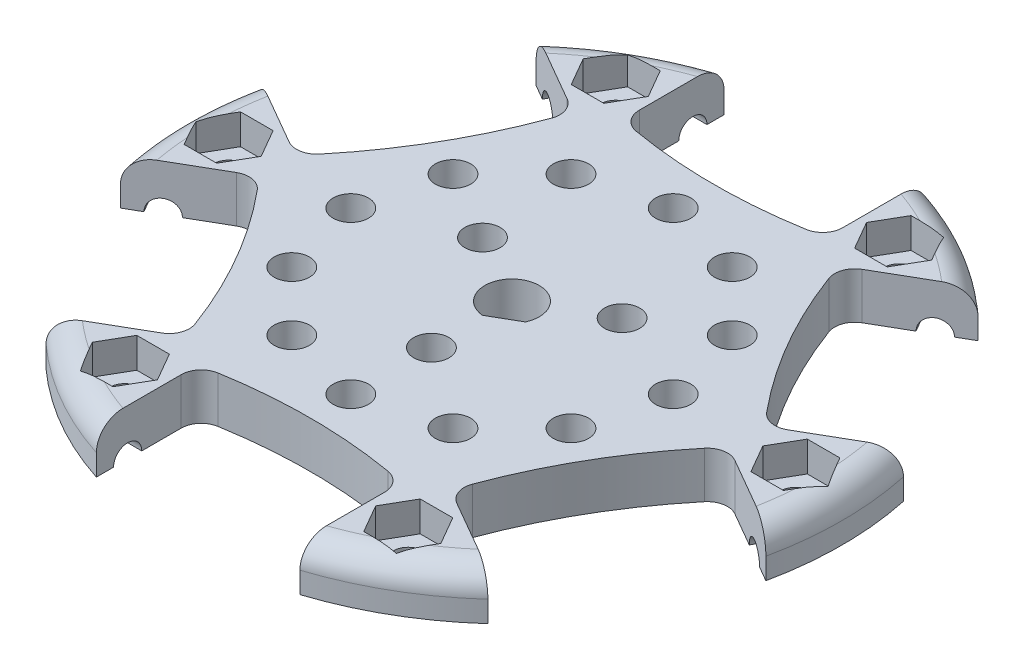
from build123d import *

# Parameters (mm, degrees)
CORTE_EXTRUS_O2_DEPTH  = 10
ESBO_O5_W              = 25.2
ESBO_O5_H              = 1.4
ESBO_O10_W             = 25.2
ESBO_O10_H             = 1.4
ESBO_O12_R             = 1.75
ESBO_O12_R_2           = 1.3
CORTE_EXTRUS_O4_DEPTH  = 46.434293366
CORTE_EXTRUS_O6_DEPTH  = 3
CORTE_EXTRUS_O7_DEPTH  = 10
ESBO_O16_R             = 1.5
CORTE_EXTRUS_O8_DEPTH  = 46.434293366
CORTE_EXTRUS_O9_DEPTH  = 3
CORTE_EXTRUS_O10_DEPTH = 46.434293366


with BuildPart() as part:
    # Esboço1 → Revolução3 (revolve)
    with BuildSketch(Plane.XY, mode=Mode.PRIVATE) as revolu_o3_sk:
        with BuildLine():
            Line((-32.75, 2.1), (-32.75, 0))
            Line((-32.75, 0), (0, 0))
            Line((0, 0), (0, 4.6))
            Line((0, 4.6), (-6.07, 4.6))
            Line((-6.07, 4.6), (-30.25, 4.6))
            ThreePointArc((-30.25, 4.6), (-32.017766953, 3.867766953), (-32.75, 2.1))
        make_face()
    revolve(revolu_o3_sk.sketch.rotate(Axis((0, 0, 0), (0, 1, 0)), 270), axis=Axis((0, 0, 0), (0, 1, 0)))

    # Esboço3 → Corte-extrusão2 (cut)
    with BuildSketch(Plane.XZ):
        with BuildLine():
            Line((-10.1, 71.55), (10.1, 71.55))
            Line((10.1, 71.55), (10.1, 22.738373522))
            ThreePointArc((10.1, 22.738373522), (9.628888485, 21.448993826), (8.4375, 20.767055752))
            ThreePointArc((8.4375, 20.767055752), (0, 20.05), (-8.4375, 20.767055752))
            ThreePointArc((-8.4375, 20.767055752), (-9.628888485, 21.448993826), (-10.1, 22.738373522))
            Line((-10.1, 22.738373522), (-10.1, 71.55))
        make_face()
        with BuildLine():
            Line((10.1, -71.55), (-10.1, -71.55))
            Line((-10.1, -71.55), (-10.1, -22.738373522))
            ThreePointArc((-10.1, -22.738373522), (-9.628888485, -21.448993826), (-8.4375, -20.767055752))
            ThreePointArc((-8.4375, -20.767055752), (0, -20.05), (8.4375, -20.767055752))
            ThreePointArc((8.4375, -20.767055752), (9.628888485, -21.448993826), (10.1, -22.738373522))
            Line((10.1, -22.738373522), (10.1, -71.55))
        make_face()
        with BuildLine():
            Line((56.914117641, 44.521856578), (67.014117641, 27.028143422))
            Line((67.014117641, 27.028143422), (24.742009111, 2.622330183))
            ThreePointArc((24.742009111, 2.622330183), (23.389817782, 2.385634875), (22.203547843, 3.076438532))
            ThreePointArc((22.203547843, 3.076438532), (17.363809346, 10.025), (13.766047843, 17.69061722))
            ThreePointArc((13.766047843, 17.69061722), (13.760929296, 19.063358951), (14.642009111, 20.116043339))
            Line((14.642009111, 20.116043339), (56.914117641, 44.521856578))
        make_face()
        with BuildLine():
            Line((-56.914117641, -44.521856578), (-67.014117641, -27.028143422))
            Line((-67.014117641, -27.028143422), (-24.742009111, -2.622330183))
            ThreePointArc((-24.742009111, -2.622330183), (-23.389817782, -2.385634875), (-22.203547843, -3.076438532))
            ThreePointArc((-22.203547843, -3.076438532), (-17.363809346, -10.025), (-13.766047843, -17.69061722))
            ThreePointArc((-13.766047843, -17.69061722), (-13.760929296, -19.063358951), (-14.642009111, -20.116043339))
            Line((-14.642009111, -20.116043339), (-56.914117641, -44.521856578))
        make_face()
        with BuildLine():
            Line((-67.014117641, 27.028143422), (-56.914117641, 44.521856578))
            Line((-56.914117641, 44.521856578), (-14.642009111, 20.116043339))
            ThreePointArc((-14.642009111, 20.116043339), (-13.760929296, 19.063358951), (-13.766047843, 17.69061722))
            ThreePointArc((-13.766047843, 17.69061722), (-17.363809346, 10.025), (-22.203547843, 3.076438532))
            ThreePointArc((-22.203547843, 3.076438532), (-23.389817782, 2.385634875), (-24.742009111, 2.622330183))
            Line((-24.742009111, 2.622330183), (-67.014117641, 27.028143422))
        make_face()
        with BuildLine():
            Line((67.014117641, -27.028143422), (56.914117641, -44.521856578))
            Line((56.914117641, -44.521856578), (14.642009111, -20.116043339))
            ThreePointArc((14.642009111, -20.116043339), (13.760929296, -19.063358951), (13.766047843, -17.69061722))
            ThreePointArc((13.766047843, -17.69061722), (17.363809346, -10.025), (22.203547843, -3.076438532))
            ThreePointArc((22.203547843, -3.076438532), (23.389817782, -2.385634875), (24.742009111, -2.622330183))
            Line((24.742009111, -2.622330183), (67.014117641, -27.028143422))
        make_face()
    extrude(amount=-CORTE_EXTRUS_O2_DEPTH, mode=Mode.SUBTRACT)

    # Esboço5 → Corte-Revolução3 (revolve, cut)
    with BuildSketch(Plane.XZ):
        with Locations((0, 27.35)):
            Rectangle(ESBO_O5_W, ESBO_O5_H)
    revolve(axis=Axis((-12.6, 0, 28.05), (1, 0, 0)), mode=Mode.SUBTRACT)

    # Esboço6 → Corte-Revolução4 (revolve, cut)
    with BuildSketch(Plane.XZ):
        Polygon((-29.379577011, 2.413079912), (-16.779577011, 24.236920088), (-17.992012576, 24.936920088), (-30.592012576, 3.113079912), align=None)
    revolve(axis=Axis((-30.592012576, 0, 3.113079912), (0.49999999999999983, 0, 0.8660254037844388)), mode=Mode.SUBTRACT)

    # Esboço7 → Corte-Revolução5 (revolve, cut)
    with BuildSketch(Plane.XZ):
        Polygon((-16.779577011, -24.236920088), (-29.379577011, -2.413079912), (-30.592012576, -3.113079912), (-17.992012576, -24.936920088), align=None)
    revolve(axis=Axis((-17.992012576, 0, -24.936920088), (-0.4999999999999998, 0, 0.8660254037844388)), mode=Mode.SUBTRACT)

    # Esboço8 → Corte-Revolução6 (revolve, cut)
    with BuildSketch(Plane.XZ):
        Polygon((16.779577011, 24.236920088), (29.379577011, 2.413079912), (30.592012576, 3.113079912), (17.992012576, 24.936920088), align=None)
    revolve(axis=Axis((17.992012576, 0, 24.936920088), (0.5000000000000001, 0, -0.8660254037844386)), mode=Mode.SUBTRACT)

    # Esboço10 → Corte-Revolução7 (revolve, cut)
    with BuildSketch(Plane.XZ):
        with Locations((0, -27.35)):
            Rectangle(ESBO_O10_W, ESBO_O10_H)
    revolve(axis=Axis((12.6, 0, -28.05), (-1, 0, 0)), mode=Mode.SUBTRACT)

    # Esboço11 → Corte-Revolução8 (revolve, cut)
    with BuildSketch(Plane.XZ):
        Polygon((29.379577011, -2.413079912), (16.779577011, -24.236920088), (17.992012576, -24.936920088), (30.592012576, -3.113079912), align=None)
    revolve(axis=Axis((30.592012576, 0, -3.113079912), (-0.49999999999999994, 0, -0.8660254037844387)), mode=Mode.SUBTRACT)

    # Esboço12 → Corte-extrusão4 (cut, through all)
    with BuildSketch(Plane.XZ):
        with Locations(Location((0, 16, 0), (0, 0, 270))):
            Circle(ESBO_O12_R)
        with Locations(Location((-8, 13.856406461, 0), (0, 0, 270))):
            Circle(ESBO_O12_R)
        with Locations(Location((-13.856406461, 8, 0), (0, 0, 270))):
            Circle(ESBO_O12_R)
        with Locations(Location((-16, 0, 0), (0, 0, 270))):
            Circle(ESBO_O12_R)
        with Locations(Location((-13.856406461, -8, 0), (0, 0, 270))):
            Circle(ESBO_O12_R)
        with Locations(Location((-8, -13.856406461, 0), (0, 0, 270))):
            Circle(ESBO_O12_R)
        with Locations(Location((0, -16, 0), (0, 0, 270))):
            Circle(ESBO_O12_R)
        with Locations(Location((8, -13.856406461, 0), (0, 0, 270))):
            Circle(ESBO_O12_R)
        with Locations(Location((13.856406461, -8, 0), (0, 0, 270))):
            Circle(ESBO_O12_R)
        with Locations(Location((16, 0, 0), (0, 0, 270))):
            Circle(ESBO_O12_R)
        with Locations(Location((13.856406461, 8, 0), (0, 0, 270))):
            Circle(ESBO_O12_R)
        with Locations(Location((8, 13.856406461, 0), (0, 0, 270))):
            Circle(ESBO_O12_R)
        with Locations(Location((28.129577011, 0, 0), (0, 0, 270))):
            Circle(ESBO_O12_R_2)
        with Locations(Location((14.064788505, 24.360928289, 0), (0, 0, 270))):
            Circle(ESBO_O12_R_2)
        with Locations(Location((-14.064788505, 24.360928289, 0), (0, 0, 270))):
            Circle(ESBO_O12_R_2)
        with Locations(Location((-28.129577011, 0, 0), (0, 0, 270))):
            Circle(ESBO_O12_R_2)
        with Locations(Location((14.064788505, -24.360928289, 0), (0, 0, 270))):
            Circle(ESBO_O12_R_2)
        with Locations(Location((-14.064788505, -24.360928289, 0), (0, 0, 270))):
            Circle(ESBO_O12_R_2)
        with Locations(Location((0, 8, 0), (0, 0, 270))):
            Circle(ESBO_O12_R)
        with Locations(Location((-6.92820323, -4, 0), (0, 0, 270))):
            Circle(ESBO_O12_R)
        with Locations(Location((6.92820323, -4, 0), (0, 0, 270))):
            Circle(ESBO_O12_R)
    extrude(amount=-CORTE_EXTRUS_O4_DEPTH, mode=Mode.SUBTRACT)

    # Esboço14 → Corte-extrusão6 (cut)
    with BuildSketch(Plane(origin=(0, 4.6, 0), x_dir=(1, 0, 0), z_dir=(0, 1, 0))):
        Polygon((-31.016328357, 0), (-29.572952684, -2.5), (-26.686201338, -2.5), (-25.242825665, 0), (-26.686201338, 2.5), (-29.572952684, 2.5), align=None)
        Polygon((-15.508164178, 26.860928289), (-16.951539851, 24.360928289), (-15.508164178, 21.860928289), (-12.621412832, 21.860928289), (-11.178037159, 24.360928289), (-12.621412832, 26.860928289), align=None)
        Polygon((15.508164178, 26.860928289), (12.621412832, 26.860928289), (11.178037159, 24.360928289), (12.621412832, 21.860928289), (15.508164178, 21.860928289), (16.951539851, 24.360928289), align=None)
        Polygon((31.016328357, 0), (29.572952684, 2.5), (26.686201338, 2.5), (25.242825665, 0), (26.686201338, -2.5), (29.572952684, -2.5), align=None)
        Polygon((15.508164178, -26.860928289), (16.951539851, -24.360928289), (15.508164178, -21.860928289), (12.621412832, -21.860928289), (11.178037159, -24.360928289), (12.621412832, -26.860928289), align=None)
        Polygon((-15.508164178, -26.860928289), (-12.621412832, -26.860928289), (-11.178037159, -24.360928289), (-12.621412832, -21.860928289), (-15.508164178, -21.860928289), (-16.951539851, -24.360928289), align=None)
    extrude(amount=-CORTE_EXTRUS_O6_DEPTH, mode=Mode.SUBTRACT)

    # Esboço13 → Corte-extrusão7 (cut)
    with BuildSketch(Plane.XZ):
        with BuildLine():
            Line((2.377591805, 1.052167862), (-0.277591805, 2.585138834))
            ThreePointArc((-0.277591805, 2.585138834), (-1.3, -2.25166605), (2.377591805, 1.052167862))
        make_face()
    extrude(amount=-CORTE_EXTRUS_O7_DEPTH, mode=Mode.SUBTRACT)

    # Esboço16 → Corte-extrusão8 (cut, through all)
    with BuildSketch(Plane(origin=(0, 4.6, 0), x_dir=(1, 0, 0), z_dir=(0, 1, 0))):
        with Locations(Location((14.064788505, 24.360928289, 0), (0, 0, 270))):
            Circle(ESBO_O16_R)
        with Locations(Location((28.129577011, 0, 0), (0, 0, 270))):
            Circle(ESBO_O16_R)
        with Locations(Location((14.064788505, -24.360928289, 0), (0, 0, 270))):
            Circle(ESBO_O16_R)
        with Locations(Location((-14.064788505, -24.360928289, 0), (0, 0, 270))):
            Circle(ESBO_O16_R)
        with Locations(Location((-28.129577011, 0, 0), (0, 0, 270))):
            Circle(ESBO_O16_R)
        with Locations(Location((-14.064788505, 24.360928289, 0), (0, 0, 270))):
            Circle(ESBO_O16_R)
    extrude(amount=-CORTE_EXTRUS_O8_DEPTH, mode=Mode.SUBTRACT)

    # Esboço17 → Corte-extrusão9 (cut)
    with BuildSketch(Plane(origin=(0, 4.6, 0), x_dir=(1, 0, 0), z_dir=(0, 1, 0))):
        Polygon((12.448207752, -21.560928289), (10.831626998, -24.360928289), (12.448207752, -27.160928289), (15.681369259, -27.160928289), (17.297950013, -24.360928289), (15.681369259, -21.560928289), align=None)
        Polygon((-29.746157765, 2.8), (-31.362738518, 0), (-29.746157765, -2.8), (-26.512996257, -2.8), (-24.896415503, 0), (-26.512996257, 2.8), align=None)
        Polygon((-15.681369259, 27.160928289), (-17.297950013, 24.360928289), (-15.681369259, 21.560928289), (-12.448207752, 21.560928289), (-10.831626998, 24.360928289), (-12.448207752, 27.160928289), align=None)
        Polygon((-17.297950013, -24.360928289), (-15.681369259, -27.160928289), (-12.448207752, -27.160928289), (-10.831626998, -24.360928289), (-12.448207752, -21.560928289), (-15.681369259, -21.560928289), align=None)
        Polygon((12.448207752, 27.160928289), (10.831626998, 24.360928289), (12.448207752, 21.560928289), (15.681369259, 21.560928289), (17.297950013, 24.360928289), (15.681369259, 27.160928289), align=None)
        Polygon((29.746157765, -2.8), (31.362738518, 0), (29.746157765, 2.8), (26.512996257, 2.8), (24.896415503, 0), (26.512996257, -2.8), align=None)
    extrude(amount=-CORTE_EXTRUS_O9_DEPTH, mode=Mode.SUBTRACT)

    # Esboço18 → Corte-extrusão10 (cut, through all)
    with BuildSketch(Plane(origin=(0, 4.6, 0), x_dir=(1, 0, 0), z_dir=(0, 1, 0))):
        with BuildLine():
            Line((-0.255544171, -2.68787968), (2.455544171, -1.122632096))
            ThreePointArc((2.455544171, -1.122632096), (-1.35, 2.33826859), (-0.255544171, -2.68787968))
        make_face()
    extrude(amount=-CORTE_EXTRUS_O10_DEPTH, mode=Mode.SUBTRACT)


solid = part.part
